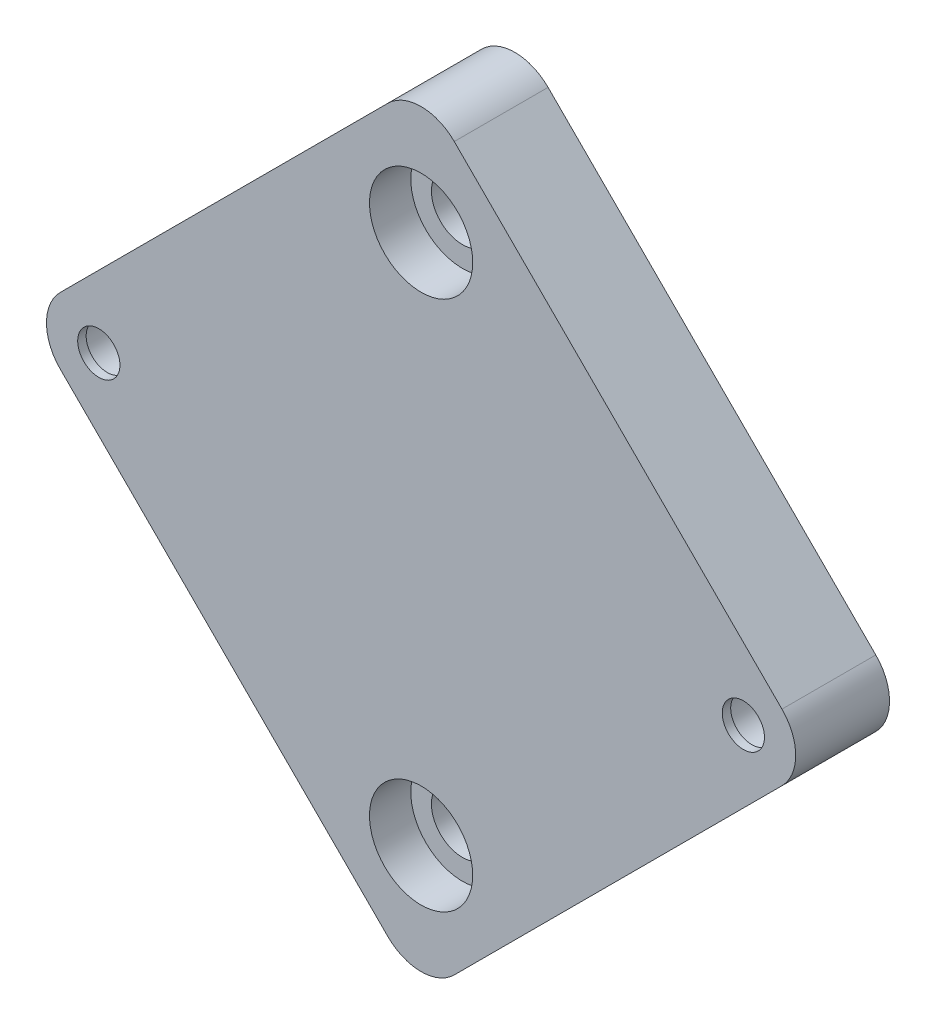
from build123d import *

# Parameters (mm, degrees)
SKETCH1_R                                           = 2.25
BOSS_EXTRUDE1_DEPTH                                 = 10
SKETCH2_R                                           = 2.8
CUT_EXTRUDE1_DEPTH                                  = 9.1
CBORE_FOR_M6_HEX_SOCKET_HEAD_CAP_SCREW1_D           = 6.6
CBORE_FOR_M6_HEX_SOCKET_HEAD_CAP_SCREW1_CBORE_D     = 11
CBORE_FOR_M6_HEX_SOCKET_HEAD_CAP_SCREW1_CBORE_DEPTH = 4.4
CBORE_FOR_M6_HEX_SOCKET_HEAD_CAP_SCR_2_D            = 6.6
CBORE_FOR_M6_HEX_SOCKET_HEAD_CAP_SCR_2_CBORE_D      = 11
CBORE_FOR_M6_HEX_SOCKET_HEAD_CAP_SCR_2_CBORE_DEPTH  = 4.4
FILLET2_R                                           = 5


with BuildPart() as part:
    # Sketch1 → Boss-Extrude1 (new body)
    with BuildSketch(Plane.XY):
        Polygon((-42, 0), (0, 42), (42, 0), (0, -42), align=None)
        with Locations((-34.35, 0)):
            Circle(SKETCH1_R, mode=Mode.SUBTRACT)
        with Locations((34.35, 0)):
            Circle(SKETCH1_R, mode=Mode.SUBTRACT)
    extrude(amount=BOSS_EXTRUDE1_DEPTH)

    # Sketch2 → Cut-Extrude1 (cut)
    with BuildSketch(Plane.XY):
        with Locations((34.35, 0)):
            Circle(SKETCH2_R)
        with Locations((-34.35, 0)):
            Circle(SKETCH2_R)
    extrude(amount=CUT_EXTRUDE1_DEPTH, mode=Mode.SUBTRACT)

    # CBORE for M6 Hex Socket Head Cap Screw1 (through all)
    with Locations(Plane(origin=(0, 28.284271247, 10), x_dir=(1, 0, 0), z_dir=(0, 0, 1))):
        with Locations((0, 0), (0, -56.568542494)):
            CounterBoreHole(CBORE_FOR_M6_HEX_SOCKET_HEAD_CAP_SCREW1_D / 2, CBORE_FOR_M6_HEX_SOCKET_HEAD_CAP_SCREW1_CBORE_D / 2, CBORE_FOR_M6_HEX_SOCKET_HEAD_CAP_SCREW1_CBORE_DEPTH)

    # CBORE for M6 Hex Socket Head Cap Scr 2 (through all)
    with Locations(Plane(origin=(55.283571739, 20.980488531, 0), x_dir=(1, 0, 0), z_dir=(0, 0, 1))):
        with Locations((0, 0)):
            CounterBoreHole(CBORE_FOR_M6_HEX_SOCKET_HEAD_CAP_SCR_2_D / 2, CBORE_FOR_M6_HEX_SOCKET_HEAD_CAP_SCR_2_CBORE_D / 2, CBORE_FOR_M6_HEX_SOCKET_HEAD_CAP_SCR_2_CBORE_DEPTH)

    # Fillet2
    fillet2_edges = [part.edges().sort_by_distance(p)[0] for p in [
        (-42, 0, 5),
        (0, 42, 5),
        (42, 0, 5),
        (0, -42, 5),
    ]]
    fillet(fillet2_edges, radius=FILLET2_R)


solid = part.part
